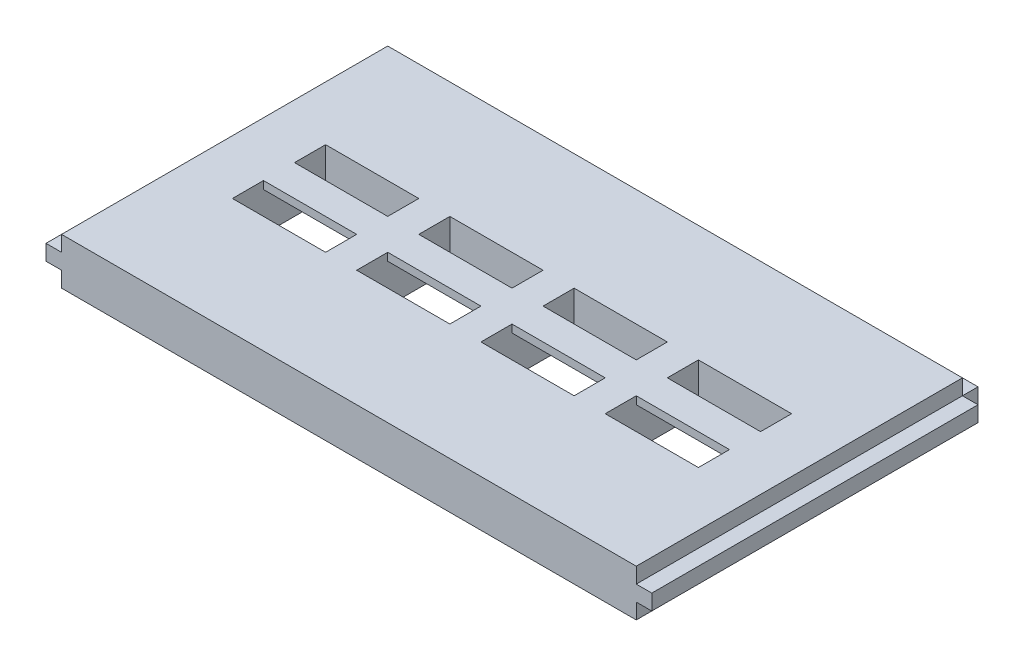
from build123d import *

# Parameters (mm, degrees)
SKETCH_1_W          = 37
SKETCH_1_H          = 21
EXTRUDE_1_DEPTH     = 3
SKETCH_2_W          = 6
SKETCH_2_H          = 2
CUT_EXTRUDE_1_DEPTH = 10
SKETCH_2_10_W       = 6
SKETCH_2_10_H       = 2
CUT_EXTRUDE_2_DEPTH = 2.5
SKETCH_5_W          = 21
SKETCH_5_H          = 1
EXTRUDE_2_DEPTH     = 1
SKETCH_7_W          = 37
SKETCH_7_H          = 1
EXTRUDE_3_DEPTH     = 1
SKETCH_8_W          = 21
SKETCH_8_H          = 1
EXTRUDE_4_DEPTH     = 1


with BuildPart() as part:
    # Эскиз1 → Бобышка-Вытянуть1 (new body)
    with BuildSketch(Plane(origin=(0, 0, 0), x_dir=(1, 0, 0), z_dir=(0, 1, 0))):
        with Locations((18.5, -10.5)):
            Rectangle(SKETCH_1_W, SKETCH_1_H)
    extrude(amount=EXTRUDE_1_DEPTH)

    # Эскиз2 → Вырез-Вытянуть1 (cut)
    with BuildSketch(Plane.XZ):
        with Locations((14.5, 12.5)):
            Rectangle(SKETCH_2_W, SKETCH_2_H)
        with Locations((14.5, 8.5)):
            Rectangle(SKETCH_2_W, SKETCH_2_H)
        with Locations((6.5, 12.5)):
            Rectangle(SKETCH_2_W, SKETCH_2_H)
        with Locations((6.5, 8.5)):
            Rectangle(SKETCH_2_W, SKETCH_2_H)
        with Locations((22.5, 12.5)):
            Rectangle(SKETCH_2_W, SKETCH_2_H)
        with Locations((22.5, 8.5)):
            Rectangle(SKETCH_2_W, SKETCH_2_H)
        with Locations((30.5, 12.5)):
            Rectangle(SKETCH_2_W, SKETCH_2_H)
        with Locations((30.5, 8.5)):
            Rectangle(SKETCH_2_W, SKETCH_2_H)
    extrude(amount=-CUT_EXTRUDE_1_DEPTH, mode=Mode.SUBTRACT)

    # Эскиз2<10> → Вырез-Вытянуть2 (cut)
    with BuildSketch(Plane.XZ):
        with Locations((14.5, 10.5)):
            Rectangle(SKETCH_2_10_W, SKETCH_2_10_H)
        with Locations((6.5, 10.5)):
            Rectangle(SKETCH_2_10_W, SKETCH_2_10_H)
        with Locations((22.5, 10.5)):
            Rectangle(SKETCH_2_10_W, SKETCH_2_10_H)
        with Locations((30.5, 10.5)):
            Rectangle(SKETCH_2_10_W, SKETCH_2_10_H)
    extrude(amount=-CUT_EXTRUDE_2_DEPTH, mode=Mode.SUBTRACT)

    # Эскиз5 → Бобышка-Вытянуть2 (add)
    with BuildSketch(Plane(origin=(37, 0, 0), x_dir=(0, 0, -1), z_dir=(1, 0, 0))):
        with Locations((-10.5, 1.5)):
            Rectangle(SKETCH_5_W, SKETCH_5_H)
    extrude(amount=EXTRUDE_2_DEPTH)

    # Эскиз7 → Бобышка-Вытянуть3 (add)
    with BuildSketch(Plane(origin=(0, 0, 0), x_dir=(-1, 0, 0), z_dir=(0, 0, -1))):
        with Locations((-18.5, 1.5)):
            Rectangle(SKETCH_7_W, SKETCH_7_H)
    extrude(amount=EXTRUDE_3_DEPTH)

    # Эскиз8 → Бобышка-Вытянуть4 (add)
    with BuildSketch(Plane.ZY):
        with Locations((10.5, 1.5)):
            Rectangle(SKETCH_8_W, SKETCH_8_H)
    extrude(amount=EXTRUDE_4_DEPTH)


solid = part.part
